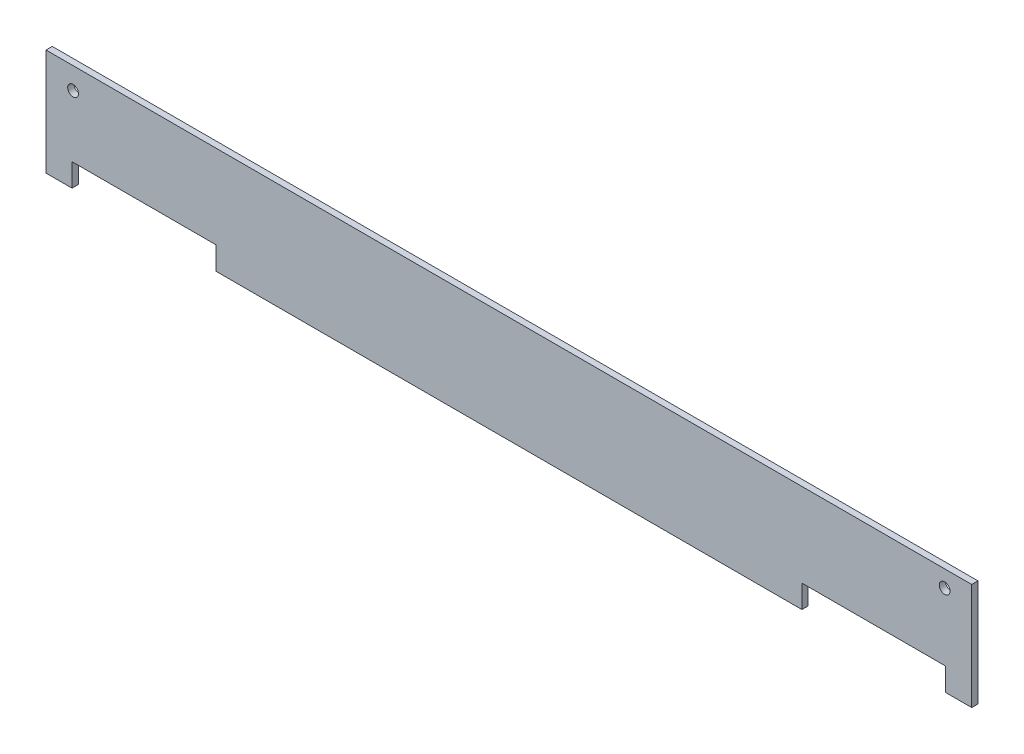
from build123d import *

# Parameters (mm, degrees)
ESQUISSE1_W             = 444.3
ESQUISSE1_H             = 51.18
BOSS_EXTRU_1_DEPTH      = 3
ESQUISSE2_R             = 2.6
ENL_V_MAT_EXTRU_1_DEPTH = 20
ESQUISSE3_W             = 69
ESQUISSE3_H             = 3
ENL_V_MAT_EXTRU_2_DEPTH = 11


with BuildPart() as part:
    # Esquisse1 → Boss.-Extru.1 (new body)
    with BuildSketch(Plane.XY):
        with Locations((-222.15, 25.59)):
            Rectangle(ESQUISSE1_W, ESQUISSE1_H)
    extrude(amount=BOSS_EXTRU_1_DEPTH)

    # Esquisse2 → Enlèv. mat.-Extru.1 (cut)
    with BuildSketch(Plane.XY.offset(3)):
        with Locations((-13, 43.165806832)):
            Circle(ESQUISSE2_R)
        with Locations((-431.3, 40.774785784)):
            Circle(ESQUISSE2_R)
    extrude(amount=-ENL_V_MAT_EXTRU_1_DEPTH, mode=Mode.SUBTRACT)

    # Esquisse3 → Enlèv. mat.-Extru.2 (cut)
    with BuildSketch(Plane.XZ):
        with Locations((-397.3, 1.5)):
            Rectangle(ESQUISSE3_W, ESQUISSE3_H)
        with Locations((-47, 1.5)):
            Rectangle(ESQUISSE3_W, ESQUISSE3_H)
    extrude(amount=-ENL_V_MAT_EXTRU_2_DEPTH, mode=Mode.SUBTRACT)


solid = part.part
